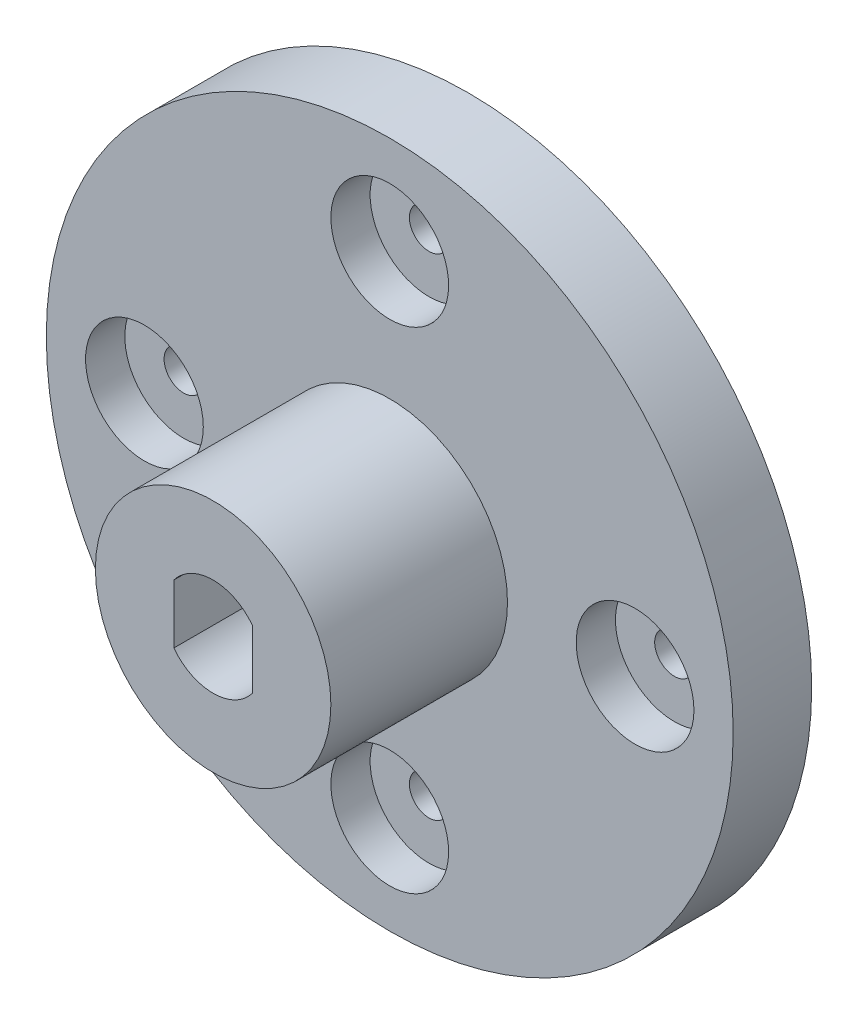
from build123d import *

# Parameters (mm, degrees)
SKETCH1_R           = 17.5
SKETCH1_R_2         = 1.5
SKETCH1_R_3         = 1
BOSS_EXTRUDE1_DEPTH = 4
SKETCH1_3_R         = 6
BOSS_EXTRUDE2_DEPTH = 9
SKETCH2_R           = 2.5
CUT_EXTRUDE1_DEPTH  = 2
SKETCH1_6_R         = 3
SKETCH1_6_R_2       = 1
CUT_EXTRUDE2_DEPTH  = 2


with BuildPart() as part:
    # Sketch1 → Boss-Extrude1 (new body)
    with BuildSketch(Plane.XY):
        Circle(SKETCH1_R)
        Circle(SKETCH1_R_2, mode=Mode.SUBTRACT)
        with Locations((0, -12.5)):
            Circle(SKETCH1_R_3, mode=Mode.SUBTRACT)
        with Locations((12.5, 0)):
            Circle(SKETCH1_R_3, mode=Mode.SUBTRACT)
        with Locations((-12.5, 0)):
            Circle(SKETCH1_R_3, mode=Mode.SUBTRACT)
        with Locations((0, 12.5)):
            Circle(SKETCH1_R_3, mode=Mode.SUBTRACT)
    extrude(amount=-BOSS_EXTRUDE1_DEPTH)

    # Sketch2 → Cut-Extrude1 (cut)
    with BuildSketch(Plane(origin=(0, 0, -4), x_dir=(-1, 0, 0), z_dir=(0, 0, -1))):
        Circle(SKETCH2_R)
    extrude(amount=-CUT_EXTRUDE1_DEPTH, mode=Mode.SUBTRACT)

    # Sketch1<6> → Cut-Extrude2 (cut)
    # profile 1 of 4: a face of its own
    with BuildSketch(Plane.XY):
        with Locations((0, 12.5)):
            Circle(SKETCH1_6_R)
        with Locations((0, 12.5)):
            Circle(SKETCH1_6_R_2, mode=Mode.SUBTRACT)
    # profile 2 of 4: a face of its own
    with BuildSketch(Plane.XY):
        with Locations((12.5, 0)):
            Circle(SKETCH1_6_R)
        with Locations((12.5, 0)):
            Circle(SKETCH1_6_R_2, mode=Mode.SUBTRACT)
    # profile 3 of 4: a face of its own
    with BuildSketch(Plane.XY):
        with Locations((0, -12.5)):
            Circle(SKETCH1_6_R)
        with Locations((0, -12.5)):
            Circle(SKETCH1_6_R_2, mode=Mode.SUBTRACT)
    # profile 4 of 4: a face of its own
    with BuildSketch(Plane.XY):
        with Locations((-12.5, 0)):
            Circle(SKETCH1_6_R)
        with Locations((-12.5, 0)):
            Circle(SKETCH1_6_R_2, mode=Mode.SUBTRACT)
    extrude(amount=-CUT_EXTRUDE2_DEPTH, mode=Mode.SUBTRACT)


with BuildPart() as body_2:
    # Sketch1<3> → Boss-Extrude2 (new body)
    with BuildSketch(Plane.XY):
        Circle(SKETCH1_3_R)
        with BuildLine():
            Line((-2, -1.5), (-2, 1.5))
            ThreePointArc((-2, 1.5), (0, 2.5), (2, 1.5))
            Line((2, 1.5), (2, -1.5))
            ThreePointArc((2, -1.5), (0, -2.5), (-2, -1.5))
        make_face(mode=Mode.SUBTRACT)
    extrude(amount=BOSS_EXTRUDE2_DEPTH)


solid = Compound([part.part, body_2.part])
